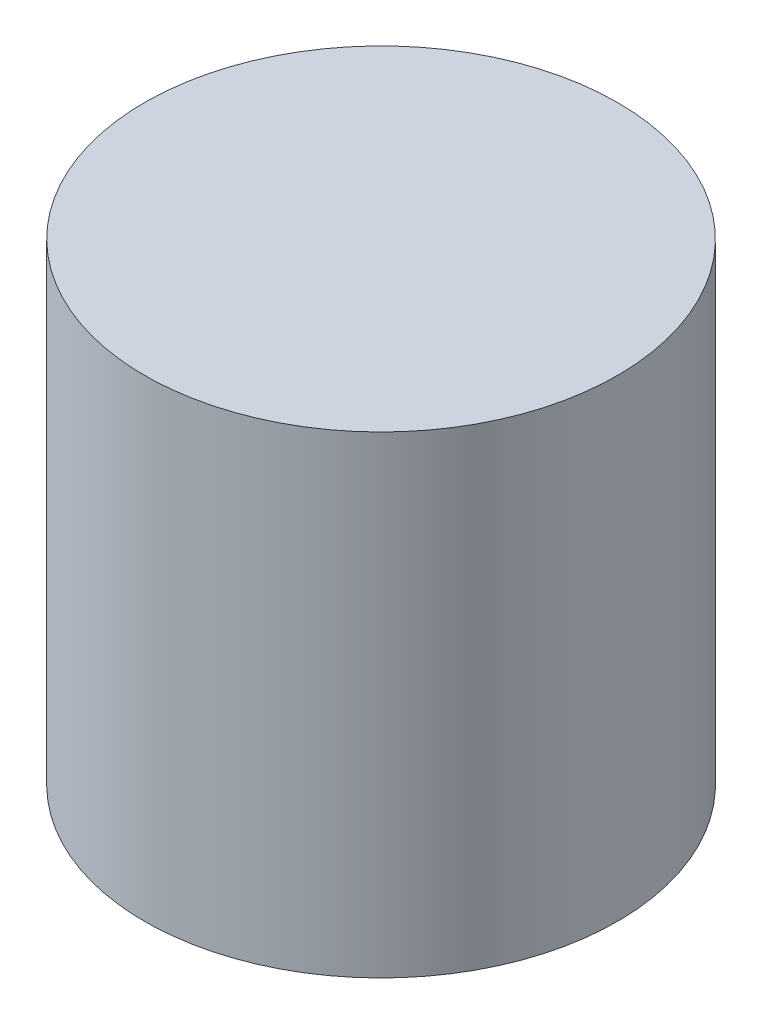
from build123d import *

# Parameters (mm, degrees)
SKETCH1_W           = 35
SKETCH1_H           = 70
CUT_EXTRUDE17_DEPTH = 2.5
CUT_EXTRUDE25_DEPTH = 116


with BuildPart() as part:
    # Sketch1 → Revolve1 (revolve)
    with BuildSketch(Plane.XY, mode=Mode.PRIVATE) as revolve1_sk:
        with Locations((17.5, 35)):
            Rectangle(SKETCH1_W, SKETCH1_H)
    revolve(revolve1_sk.sketch.rotate(Axis((0, 0, 0), (0, 1, 0)), 90), axis=Axis((0, 0, 0), (0, 1, 0)))

    # 3DSketch2 → Cut-Extrude17 (cut)
    with BuildSketch(Plane(origin=(-32.691742077, 65, 12.5), x_dir=(0, -0.923076923076923, -0.38461538461538475), z_dir=(1, 0, 0))):
        Polygon((0, 0), (9.615384615, 23.076923077), (65, 0), (55.384615385, -23.076923077), align=None)
    extrude(amount=-CUT_EXTRUDE17_DEPTH, mode=Mode.SUBTRACT)

    # 3DSketch3 → Cut-Extrude25 (cut, along a direction that is not the sketch's normal)
    with BuildSketch(Plane(origin=(-18.666557597, 54.986311826, -29.606749695), x_dir=(0.6694273156469549, -0.7427399140993083, -0.014299967463753989), z_dir=(0.021356621715658074, -1.1658435530169433e-15, 0.9997719213445107))):
        Polygon((0, 0), (24.145055974, 26.783201302), (53.854652538, 0), (29.709596564, -26.783201302), align=None)
    extrude(amount=-CUT_EXTRUDE25_DEPTH, dir=(0, 0, 1), mode=Mode.SUBTRACT)


solid = part.part
